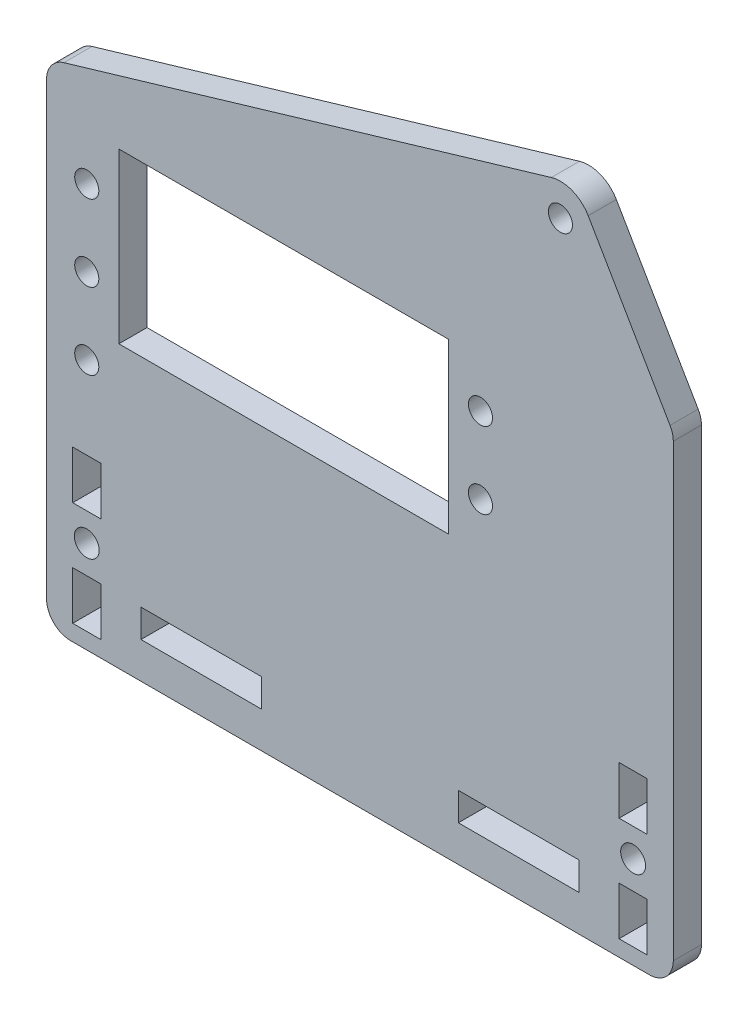
from build123d import *

# Parameters (mm, degrees)
SKETCH1_R           = 1.5
SKETCH1_W           = 41
SKETCH1_H           = 21
BOSS_EXTRUDE1_DEPTH = 3.5
SKETCH2_R           = 1.55
SKETCH2_W           = 3.5
SKETCH2_H           = 6
CUT_EXTRUDE1_DEPTH  = 63.723600024
SKETCH3_W           = 15
SKETCH3_H           = 3.5
CUT_EXTRUDE2_DEPTH  = 63.723600024
SKETCH4_R           = 1.5
CUT_EXTRUDE3_DEPTH  = 63.723600024
CUT_EXTRUDE5_REACH  = 64.724
SKETCH5_R           = 1.5


with BuildPart() as part:
    # Sketch1 → Boss-Extrude1 (new body)
    with BuildSketch(Plane.XY):
        with BuildLine():
            Line((-36, -31), (36, -31))
            ThreePointArc((36, -31), (38.121320344, -30.121320344), (39, -28))
            Line((39, -28), (39, 28))
            ThreePointArc((39, 28), (38.896468429, 28.781326206), (38.593019574, 29.508724458))
            Line((38.593019574, 29.508724458), (28.409114334, 47.011632611))
            ThreePointArc((28.409114334, 47.011632611), (26.428070455, 48.717592284), (23.81637841, 48.835481746))
            Line((23.81637841, 48.835481746), (-36.851532369, 30.876611309))
            ThreePointArc((-36.851532369, 30.876611309), (-38.403601164, 29.795188415), (-39, 28))
            Line((-39, 28), (-39, -28))
            ThreePointArc((-39, -28), (-38.121320344, -30.121320344), (-36, -31))
        make_face()
        with Locations((24.951754903, 45)):
            Circle(SKETCH1_R, mode=Mode.SUBTRACT)
        with Locations((-9.5, 14.5)):
            Rectangle(SKETCH1_W, SKETCH1_H, mode=Mode.SUBTRACT)
    extrude(amount=BOSS_EXTRUDE1_DEPTH)

    # Sketch2 → Cut-Extrude1 (cut, through all)
    with BuildSketch(Plane(origin=(0, 0, 0), x_dir=(-1, 0, 0), z_dir=(0, 0, -1))):
        with Locations((-34, -19.5)):
            Circle(SKETCH2_R)
        with Locations(Location((34, -19.5, 0), (0, 0, 180))):
            Circle(SKETCH2_R)
        with Locations((-34, -13)):
            Rectangle(SKETCH2_W, SKETCH2_H)
        with Locations((-34, -26)):
            Rectangle(SKETCH2_W, SKETCH2_H)
        with Locations((34, -26)):
            Rectangle(SKETCH2_W, SKETCH2_H)
        with Locations((34, -13)):
            Rectangle(SKETCH2_W, SKETCH2_H)
    extrude(amount=-CUT_EXTRUDE1_DEPTH, mode=Mode.SUBTRACT)

    # Sketch3 → Cut-Extrude2 (cut, through all)
    with BuildSketch(Plane(origin=(0, 0, 0), x_dir=(-1, 0, 0), z_dir=(0, 0, -1))):
        with Locations((19.75, -24.75)):
            Rectangle(SKETCH3_W, SKETCH3_H)
        with Locations((-19.75, -24.75)):
            Rectangle(SKETCH3_W, SKETCH3_H)
    extrude(amount=-CUT_EXTRUDE2_DEPTH, mode=Mode.SUBTRACT)

    # Sketch4 → Cut-Extrude3 (cut, through all)
    with BuildSketch(Plane(origin=(0, 0, 0), x_dir=(-1, 0, 0), z_dir=(0, 0, -1))):
        with Locations((-15, 19.25)):
            Circle(SKETCH4_R)
        with Locations((-15, 9.75)):
            Circle(SKETCH4_R)
        with Locations((34, 9.75)):
            Circle(SKETCH4_R)
        with Locations((34, 19.25)):
            Circle(SKETCH4_R)
    extrude(amount=-CUT_EXTRUDE3_DEPTH, mode=Mode.SUBTRACT)

    # Sketch5 → Cut-Extrude5 (cut, up to next)
    with BuildSketch(Plane(origin=(0, 0, 0), x_dir=(-1, 0, 0), z_dir=(0, 0, -1)), mode=Mode.PRIVATE) as cut_extrude5_sk1:
        with Locations((34, 0.25)):
            Circle(SKETCH5_R)
    cut_extrude5_tool1 = extrude(cut_extrude5_sk1.sketch, amount=-CUT_EXTRUDE5_REACH, mode=Mode.PRIVATE) & part.part
    add(cut_extrude5_tool1.solids().sort_by_distance((-34, 0.25, 0))[0], mode=Mode.SUBTRACT)


solid = part.part
